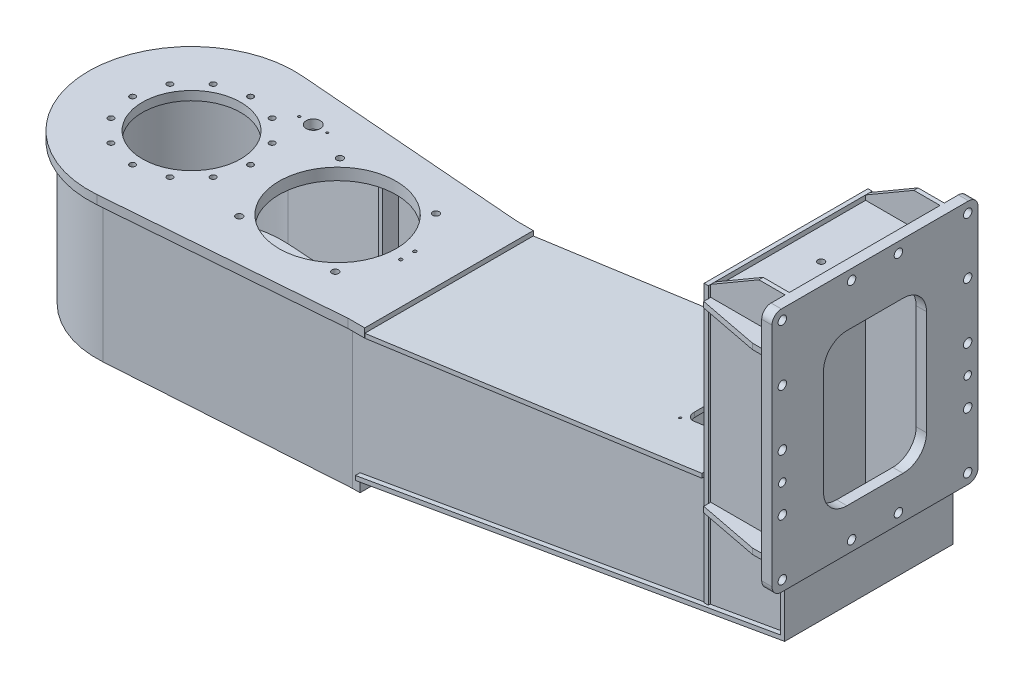
from build123d import *

# Parameters (mm, degrees)
SKETCH_1_R               = 203
SKETCH_1_R_2             = 194
EXTRUDE_1_DEPTH          = 301
CUT_EXTRUDE_1_DEPTH      = 416.955526469
CUT_EXTRUDE_1_DEPTH_BACK = 416.955526469
EXTRUDE_START            = 20
SKETCH_4_R               = 194
EXTRUDE_2_DEPTH          = 20
EXTRUDE_3_DEPTH          = 20
SKETCH_7_R               = 159
CUT_EXTRUDE_3_DEPTH      = 20
CUT_EXTRUDE_5_DEPTH      = 20
FILLET_1_R               = 25
EXTRUDE_4_DEPTH          = 301
SKETCH_11_R              = 220
EXTRUDE_5_DEPTH          = 19
EXTRUDE_6_DEPTH          = 19
SKETCH_13_W              = 300
SKETCH_13_H              = 270
EXTRUDE_7_DEPTH          = 6
EXTRUDE_8_DEPTH          = 12
CUT_EXTRUDE_7_DEPTH      = 12
EXTRUDE_9_DEPTH          = 9
EXTRUDE_10_DEPTH         = 9
EXTRUDE_11_DEPTH         = 180
EXTRUDE_11_DEPTH_BACK    = 180
EXTRUDE_12_DEPTH         = 180
EXTRUDE_12_DEPTH_BACK    = 180
EXTRUDE_13_DEPTH         = 161
EXTRUDE_13_DEPTH_BACK    = 161
CUT_EXTRUDE_8_DEPTH      = 9
SKETCH_31_W              = 350
SKETCH_31_H              = 591
EXTRUDE_14_DEPTH         = 9
EXTRUDE_16_DEPTH         = 9
EXTRUDE_17_DEPTH         = 9
EXTRUDE_18_DEPTH         = 12
EXTRUDE_19_DEPTH         = 12
SKETCH_43_W              = 159
SKETCH_43_H              = 322
EXTRUDE_20_DEPTH         = 12
EXTRUDE_21_DEPTH         = 22
CUT_EXTRUDE_10_DEPTH     = 22
EXTRUDE_22_DEPTH         = 301
SKETCH_50_R              = 105
CUT_EXTRUDE_12_DEPTH     = 19
SKETCH_52_R              = 6
CUT_EXTRUDE_14_DEPTH     = 19
SKETCH_54_R              = 15
CUT_EXTRUDE_16_DEPTH     = 19
SKETCH_56_R              = 2.5
CUT_EXTRUDE_18_DEPTH     = 19
SKETCH_59_R              = 125
CUT_EXTRUDE_20_DEPTH     = 25
SKETCH_61_R              = 7
CUT_EXTRUDE_22_DEPTH     = 25
SKETCH_63_R              = 3.4
CUT_EXTRUDE_24_DEPTH     = 25
CUT_EXTRUDE_25_DEPTH     = 9
SKETCH_65_R              = 2.5
CUT_EXTRUDE_26_DEPTH     = 9
SKETCH_67_R              = 65
CUT_EXTRUDE_28_DEPTH     = 9
SKETCH_69_R              = 2.5
CUT_EXTRUDE_30_DEPTH     = 9
SKETCH_71_R              = 7
CUT_EXTRUDE_32_DEPTH     = 12
SKETCH_73_R              = 9
CUT_EXTRUDE_34_DEPTH     = 22
SKETCH_75_R              = 8
CUT_EXTRUDE_36_DEPTH     = 22
EXTRUDE_23_DEPTH         = 9
EXTRUDE_24_DEPTH         = 9


with BuildPart() as part:
    # ｽｹｯﾁ1 → ﾎﾞｽ - 押し出し1 (new body)
    with BuildSketch(Plane(origin=(0, 0, 0), x_dir=(1, 0, 0), z_dir=(0, 1, 0))):
        with Locations(Location((0, 0, 0), (0, 0, 270))):
            Circle(SKETCH_1_R)
        with Locations(Location((0, 0, 0), (0, 0, 270))):
            Circle(SKETCH_1_R_2, mode=Mode.SUBTRACT)
    extrude(amount=-EXTRUDE_1_DEPTH)

    # ｽｹｯﾁ2 → ｶｯﾄ - 押し出し1 (cut, two sides: drawn at the far end of the back side and taken through both)
    with BuildSketch(Plane(origin=(0, 0, 0), x_dir=(1, 0, 0), z_dir=(0, 1, 0)).offset(-CUT_EXTRUDE_1_DEPTH_BACK)):
        Polygon((0, 0), (16.224897935, -249.47294981), (300, -249.47294981), (300, 249.47294981), (16.224897935, 249.47294981), align=None)
    extrude(amount=CUT_EXTRUDE_1_DEPTH + CUT_EXTRUDE_1_DEPTH_BACK, mode=Mode.SUBTRACT)

    # ｽｹｯﾁ4 → ﾎﾞｽ - 押し出し2 (add)
    with BuildSketch(Plane(origin=(0, -301, 0), x_dir=(1, 0, 0), z_dir=(0, 1, 0)).offset(EXTRUDE_START)):
        Circle(SKETCH_4_R)
    extrude(amount=-EXTRUDE_2_DEPTH)

    # ｽｹｯﾁ5 → ﾎﾞｽ - 押し出し3 (add)
    with BuildSketch(Plane(origin=(0, -301, 0), x_dir=(1, 0, 0), z_dir=(0, 1, 0))):
        Polygon((12.590520797, -193.591009053), (513.7, -161), (518, -161), (518, 161), (513.7, 161), (12.590520797, 193.591009053), align=None)
    extrude(amount=EXTRUDE_3_DEPTH)

    # ｽｹｯﾁ7 → ｶｯﾄ - 押し出し3 (cut)
    with BuildSketch(Plane(origin=(0, -301, 0), x_dir=(1, 0, 0), z_dir=(0, 1, 0))):
        with Locations(Location((0, 0, 0), (0, 0, 270))):
            Circle(SKETCH_7_R)
    extrude(amount=CUT_EXTRUDE_3_DEPTH, mode=Mode.SUBTRACT)

    # ｽｹｯﾁ9 → ｶｯﾄ - 押し出し5 (cut)
    with BuildSketch(Plane(origin=(0, -301, 0), x_dir=(1, 0, 0), z_dir=(0, 1, 0))):
        Polygon((10.319035087, -158.664796079), (468.0175, -128.897597336), (468.0175, 128.897597336), (10.319035087, 158.664796079), align=None)
    extrude(amount=CUT_EXTRUDE_5_DEPTH, mode=Mode.SUBTRACT)

    # ﾌｨﾚｯﾄ1
    fillet_1_edges = [part.edges().sort_by_distance(p)[0] for p in [
        (468.0175, -291, 128.897597336),
        (468.0175, -291, -128.897597336),
    ]]
    fillet(fillet_1_edges, radius=FILLET_1_R)

    # ｽｹｯﾁ10 → ﾎﾞｽ - 押し出し4 (add)
    with BuildSketch(Plane(origin=(0, 0, 0), x_dir=(1, 0, 0), z_dir=(0, 1, 0))):
        Polygon((12.590520797, 193.591009053), (513.7, 161), (530, 161), (530, 170), (514, 170), (13.174617123, 202.572035246), align=None)
        Polygon((12.590520797, -193.591009053), (513.7, -161), (530, -161), (530, -170), (514, -170), (13.174617123, -202.572035246), align=None)
    extrude(amount=-EXTRUDE_4_DEPTH)

    # ｽｹｯﾁ11 → ﾎﾞｽ - 押し出し5 (add)
    with BuildSketch(Plane(origin=(0, 0, 0), x_dir=(1, 0, 0), z_dir=(0, 1, 0))):
        with Locations(Location((0, 0, 0), (0, 0, 63.607016217))):
            Circle(SKETCH_11_R)
    extrude(amount=EXTRUDE_5_DEPTH)

    # ｽｹｯﾁ12 → ﾎﾞｽ - 押し出し6 (add)
    with BuildSketch(Plane(origin=(0, 0, 0), x_dir=(1, 0, 0), z_dir=(0, 1, 0))):
        Polygon((17.350560709, -219.314746524), (514.3, -180), (550, -180), (550, 180), (514.3, 180), (17.350560709, 219.314746524), align=None)
    extrude(amount=EXTRUDE_6_DEPTH)

    # ｽｹｯﾁ13 → ﾎﾞｽ - 押し出し7 (add)
    with BuildSketch(Plane(origin=(0, 0, 0), x_dir=(1, 0, 0), z_dir=(0, 1, 0))):
        with Locations((325, 0)):
            Rectangle(SKETCH_13_W, SKETCH_13_H)
    extrude(amount=-EXTRUDE_7_DEPTH)

    # ｽｹｯﾁ15 → ﾎﾞｽ - 押し出し8 (add)
    with BuildSketch(Plane(origin=(518, 0, 0), x_dir=(0, 0, -1), z_dir=(1, 0, 0))):
        Polygon((161, -301), (-161, -301), (-161, -7), (-151, 3), (151, 3), (161, -7), align=None)
    extrude(amount=EXTRUDE_8_DEPTH)

    # ｽｹｯﾁ17 → ｶｯﾄ - 押し出し7 (cut)
    with BuildSketch(Plane(origin=(518, 0, 0), x_dir=(0, 0, -1), z_dir=(1, 0, 0))):
        with BuildLine():
            Line((-111, -220), (-111, -97))
            ThreePointArc((-111, -97), (-102.213203436, -75.786796564), (-81, -67))
            Line((-81, -67), (81, -67))
            ThreePointArc((81, -67), (102.213203436, -75.786796564), (111, -97))
            Line((111, -97), (111, -220))
            ThreePointArc((111, -220), (102.213203436, -241.213203436), (81, -250))
            Line((81, -250), (-81, -250))
            ThreePointArc((-81, -250), (-102.213203436, -241.213203436), (-111, -220))
        make_face()
    extrude(amount=CUT_EXTRUDE_7_DEPTH, mode=Mode.SUBTRACT)

    # ｽｹｯﾁ20 → ﾎﾞｽ - 押し出し9 (add)
    with BuildSketch(Plane.XY.offset(161)):
        Polygon((530, -273.136944141), (1270, -143.555446343), (1270, 109.988063889), (530, 6.215108965), align=None)
    extrude(amount=EXTRUDE_9_DEPTH)

    # ｽｹｯﾁ21 → ﾎﾞｽ - 押し出し10 (add)
    with BuildSketch(Plane.XY.offset(-161)):
        Polygon((530, -273.136944141), (1270, -143.555446343), (1270, 109.988063889), (530, 6.215108965), align=None)
    extrude(amount=-EXTRUDE_10_DEPTH)

    # ｽｹｯﾁ22 → ﾎﾞｽ - 押し出し11 (add, two sides: drawn at the far end of the back side and taken through both)
    with BuildSketch(Plane.XY.offset(-EXTRUDE_11_DEPTH_BACK)):
        Polygon((551.2, 0.1), (1270, 100.9), (1270, 109.988063889), (549.950126354, 9.012789455), align=None)
    extrude(amount=EXTRUDE_11_DEPTH + EXTRUDE_11_DEPTH_BACK)

    # ｽｹｯﾁ23 → ﾎﾞｽ - 押し出し12 (add, two sides: drawn at the far end of the back side and taken through both)
    with BuildSketch(Plane.XY.offset(-EXTRUDE_12_DEPTH_BACK)):
        Polygon((530, -264), (1438, -105), (1438, -5), (1447, -5), (1447, -112.560952951), (530, -273.136944141), align=None)
    extrude(amount=EXTRUDE_12_DEPTH + EXTRUDE_12_DEPTH_BACK)

    # ｽｹｯﾁ24 → ﾎﾞｽ - 押し出し13 (add, two sides: drawn at the far end of the back side and taken through both)
    with BuildSketch(Plane.XY.offset(-EXTRUDE_13_DEPTH_BACK)):
        Polygon((909.050126354, 59.370719338), (917.962915808, 60.620592985), (954.346576527, -198.829559044), (945.476333395, -200.382828491), align=None)
    extrude(amount=EXTRUDE_13_DEPTH + EXTRUDE_13_DEPTH_BACK)

    # ｽｹｯﾁ29 → ｶｯﾄ - 押し出し8 (cut)
    with BuildSketch(Plane(origin=(908.595975782, 127.41579627, 0), x_dir=(0, 0, -1), z_dir=(0.9903099394368974, 0.1388748496038389, 0))):
        with BuildLine():
            Line((81, -270.017190662), (-81, -270.017190662))
            ThreePointArc((-81, -270.017190662), (-102.213203436, -261.230394097), (-111, -240.017190662))
            Line((-111, -240.017190662), (-111, -157.017190662))
            ThreePointArc((-111, -157.017190662), (-102.213203436, -135.803987226), (-81, -127.017190662))
            Line((-81, -127.017190662), (81, -127.017190662))
            ThreePointArc((81, -127.017190662), (102.213203436, -135.803987226), (111, -157.017190662))
            Line((111, -157.017190662), (111, -240.017190662))
            ThreePointArc((111, -240.017190662), (102.213203436, -261.230394097), (81, -270.017190662))
        make_face()
    extrude(amount=-CUT_EXTRUDE_8_DEPTH, mode=Mode.SUBTRACT)

    # ｽｹｯﾁ31 → ﾎﾞｽ - 押し出し14 (add)
    with BuildSketch(Plane(origin=(1270, 0, 0), x_dir=(0, 0, -1), z_dir=(1, 0, 0))):
        with Locations((0, 163.5)):
            Rectangle(SKETCH_31_W, SKETCH_31_H)
    extrude(amount=EXTRUDE_14_DEPTH)

    # ｽｹｯﾁ36 → ﾎﾞｽ - 押し出し16 (add)
    with BuildSketch(Plane.XY.offset(161)):
        Polygon((1279, -5), (1460, -5), (1460, 519), (1382, 519), (1279, 459), align=None)
    extrude(amount=EXTRUDE_16_DEPTH)

    # ｽｹｯﾁ37 → ﾎﾞｽ - 押し出し17 (add)
    with BuildSketch(Plane.XY.offset(-161)):
        Polygon((1279, -5), (1460, -5), (1460, 519), (1382, 519), (1279, 459), align=None)
    extrude(amount=-EXTRUDE_17_DEPTH)

    # ｽｹｯﾁ39 → ﾎﾞｽ - 押し出し18 (add)
    with BuildSketch(Plane(origin=(0, 44, 0), x_dir=(1, 0, 0), z_dir=(0, 1, 0))):
        Polygon((1279, 170), (1431, 170), (1438, 177), (1438, 203), (1431, 210), (1408, 210), (1279, 185), align=None)
        Polygon((1279, -170), (1431, -170), (1438, -177), (1438, -203), (1431, -210), (1408, -210), (1279, -185), align=None)
    extrude(amount=EXTRUDE_18_DEPTH)

    # ｽｹｯﾁ41 → ﾎﾞｽ - 押し出し19 (add)
    with BuildSketch(Plane(origin=(0, 423, 0), x_dir=(1, 0, 0), z_dir=(0, 1, 0))):
        Polygon((1279, 170), (1431, 170), (1438, 177), (1438, 203), (1431, 210), (1408, 210), (1279, 185), align=None)
        Polygon((1279, -170), (1431, -170), (1438, -177), (1438, -203), (1431, -210), (1408, -210), (1279, -185), align=None)
    extrude(amount=EXTRUDE_19_DEPTH)

    # ｽｹｯﾁ43 → ﾎﾞｽ - 押し出し20 (add)
    with BuildSketch(Plane(origin=(0, 437, 0), x_dir=(1, 0, 0), z_dir=(0, 1, 0))):
        with Locations((1358.5, 0)):
            Rectangle(SKETCH_43_W, SKETCH_43_H)
    extrude(amount=EXTRUDE_20_DEPTH)

    # ｽｹｯﾁ45 → ﾎﾞｽ - 押し出し21 (add)
    with BuildSketch(Plane(origin=(1438, 0, 0), x_dir=(0, 0, -1), z_dir=(1, 0, 0))):
        with BuildLine():
            Line((-220, 15), (-220, 499))
            ThreePointArc((-220, 499), (-214.142135624, 513.142135624), (-200, 519))
            Line((-200, 519), (200, 519))
            ThreePointArc((200, 519), (214.142135624, 513.142135624), (220, 499))
            Line((220, 499), (220, 15))
            ThreePointArc((220, 15), (214.142135624, 0.857864376), (200, -5))
            Line((200, -5), (-200, -5))
            ThreePointArc((-200, -5), (-214.142135624, 0.857864376), (-220, 15))
        make_face()
    extrude(amount=EXTRUDE_21_DEPTH)

    # ｽｹｯﾁ47 → ｶｯﾄ - 押し出し10 (cut)
    with BuildSketch(Plane(origin=(1438, 0, 0), x_dir=(0, 0, -1), z_dir=(1, 0, 0))):
        with BuildLine():
            Line((-110, 135), (-110, 359))
            ThreePointArc((-110, 359), (-95.355339059, 394.355339059), (-60, 409))
            Line((-60, 409), (60, 409))
            ThreePointArc((60, 409), (95.355339059, 394.355339059), (110, 359))
            Line((110, 359), (110, 135))
            ThreePointArc((110, 135), (95.355339059, 99.644660941), (60, 85))
            Line((60, 85), (-60, 85))
            ThreePointArc((-60, 85), (-95.355339059, 99.644660941), (-110, 135))
        make_face()
    extrude(amount=CUT_EXTRUDE_10_DEPTH, mode=Mode.SUBTRACT)

    # ｽｹｯﾁ48 → ﾎﾞｽ - 押し出し22 (add)
    with BuildSketch(Plane(origin=(0, 0, 0), x_dir=(1, 0, 0), z_dir=(0, 1, 0))):
        Polygon((253.6175, 145.9656), (262.6175, 145.3656), (264.7175, 177.193501799), (255.7175, 177.778832118), align=None)
        Polygon((253.6175, -145.9656), (262.6175, -145.3656), (264.7175, -177.193501799), (255.7175, -177.778832118), align=None)
    extrude(amount=-EXTRUDE_22_DEPTH)

    # ｽｹｯﾁ50 → ｶｯﾄ - 押し出し12 (cut)
    with BuildSketch(Plane(origin=(0, 0, 0), x_dir=(1, 0, 0), z_dir=(0, 1, 0))):
        with Locations(Location((0, 0, 0), (0, 0, 270))):
            Circle(SKETCH_50_R)
    extrude(amount=CUT_EXTRUDE_12_DEPTH, mode=Mode.SUBTRACT)

    # ｽｹｯﾁ52 → ｶｯﾄ - 押し出し14 (cut)
    with BuildSketch(Plane(origin=(0, 0, 0), x_dir=(1, 0, 0), z_dir=(0, 1, 0))):
        with Locations(Location((126, 0, 0), (0, 0, 270))):
            Circle(SKETCH_52_R)
        with Locations(Location((109.119200877, -63, 0), (0, 0, 270))):
            Circle(SKETCH_52_R)
        with Locations(Location((63, -109.119200877, 0), (0, 0, 270))):
            Circle(SKETCH_52_R)
        with Locations(Location((0, -126, 0), (0, 0, 270))):
            Circle(SKETCH_52_R)
        with Locations(Location((-63, -109.119200877, 0), (0, 0, 270))):
            Circle(SKETCH_52_R)
        with Locations(Location((-109.119200877, -63, 0), (0, 0, 270))):
            Circle(SKETCH_52_R)
        with Locations(Location((-126, 0, 0), (0, 0, 270))):
            Circle(SKETCH_52_R)
        with Locations(Location((-109.119200877, 63, 0), (0, 0, 270))):
            Circle(SKETCH_52_R)
        with Locations(Location((-63, 109.119200877, 0), (0, 0, 270))):
            Circle(SKETCH_52_R)
        with Locations(Location((0, 126, 0), (0, 0, 270))):
            Circle(SKETCH_52_R)
        with Locations(Location((63, 109.119200877, 0), (0, 0, 270))):
            Circle(SKETCH_52_R)
        with Locations(Location((109.119200877, 63, 0), (0, 0, 270))):
            Circle(SKETCH_52_R)
    extrude(amount=CUT_EXTRUDE_14_DEPTH, mode=Mode.SUBTRACT)

    # ｽｹｯﾁ54 → ｶｯﾄ - 押し出し16 (cut)
    with BuildSketch(Plane(origin=(0, 0, 0), x_dir=(1, 0, 0), z_dir=(0, 1, 0))):
        with Locations(Location((119, 141, 0), (0, 0, 270))):
            Circle(SKETCH_54_R)
    extrude(amount=CUT_EXTRUDE_16_DEPTH, mode=Mode.SUBTRACT)

    # ｽｹｯﾁ56 → ｶｯﾄ - 押し出し18 (cut)
    with BuildSketch(Plane(origin=(0, 0, 0), x_dir=(1, 0, 0), z_dir=(0, 1, 0))):
        with Locations(Location((89, 141, 0), (0, 0, 270))):
            Circle(SKETCH_56_R)
        with Locations(Location((149, 141, 0), (0, 0, 270))):
            Circle(SKETCH_56_R)
    extrude(amount=CUT_EXTRUDE_18_DEPTH, mode=Mode.SUBTRACT)

    # ｽｹｯﾁ59 → ｶｯﾄ - 押し出し20 (cut)
    with BuildSketch(Plane(origin=(0, -6, 0), x_dir=(1, 0, 0), z_dir=(0, 1, 0))):
        with Locations(Location((312, 0, 0), (0, 0, 270))):
            Circle(SKETCH_59_R)
    extrude(amount=CUT_EXTRUDE_20_DEPTH, mode=Mode.SUBTRACT)

    # ｽｹｯﾁ61 → ｶｯﾄ - 押し出し22 (cut)
    with BuildSketch(Plane(origin=(0, -6, 0), x_dir=(1, 0, 0), z_dir=(0, 1, 0))):
        with Locations(Location((209.5, 107.5, 0), (0, 0, 270))):
            Circle(SKETCH_61_R)
        with Locations(Location((209.5, -107.5, 0), (0, 0, 270))):
            Circle(SKETCH_61_R)
        with Locations(Location((414.5, 107.5, 0), (0, 0, 270))):
            Circle(SKETCH_61_R)
        with Locations(Location((414.5, -107.5, 0), (0, 0, 270))):
            Circle(SKETCH_61_R)
    extrude(amount=CUT_EXTRUDE_22_DEPTH, mode=Mode.SUBTRACT)

    # ｽｹｯﾁ63 → ｶｯﾄ - 押し出し24 (cut)
    with BuildSketch(Plane(origin=(0, -6, 0), x_dir=(1, 0, 0), z_dir=(0, 1, 0))):
        with Locations(Location((462, 15, 0), (0, 0, 270))):
            Circle(SKETCH_63_R)
        with Locations(Location((462, -15, 0), (0, 0, 270))):
            Circle(SKETCH_63_R)
    extrude(amount=CUT_EXTRUDE_24_DEPTH, mode=Mode.SUBTRACT)

    # ｽｹｯﾁ64 → ｶｯﾄ - 押し出し25 (cut)
    with BuildSketch(Plane(origin=(9.366940027, -66.795203285, 0), x_dir=(0.9903099394368974, 0.13887484960383872, 0), z_dir=(-0.1388748496038387, 0.9903099394368973, 0))):
        with BuildLine():
            Line((1205.576858653, 55), (1205.576858653, -55))
            ThreePointArc((1205.576858653, -55), (1199.718994277, -69.142135624), (1185.576858653, -75))
            Line((1185.576858653, -75), (1150.576858653, -75))
            ThreePointArc((1150.576858653, -75), (1136.434723029, -69.142135624), (1130.576858653, -55))
            Line((1130.576858653, -55), (1130.576858653, 55))
            ThreePointArc((1130.576858653, 55), (1136.434723029, 69.142135624), (1150.576858653, 75))
            Line((1150.576858653, 75), (1185.576858653, 75))
            ThreePointArc((1185.576858653, 75), (1199.718994277, 69.142135624), (1205.576858653, 55))
        make_face()
    extrude(amount=-CUT_EXTRUDE_25_DEPTH, mode=Mode.SUBTRACT)

    # ｽｹｯﾁ65 → ｶｯﾄ - 押し出し26 (cut)
    with BuildSketch(Plane(origin=(9.366940027, -66.795203285, 0), x_dir=(0.9903099394368974, 0.13887484960383872, 0), z_dir=(-0.1388748496038387, 0.9903099394368973, 0))):
        with Locations(Location((1125.576858653, 80, 0), (0, 0, 180))):
            Circle(SKETCH_65_R)
        with Locations(Location((1125.576858653, -80, 0), (0, 0, 180))):
            Circle(SKETCH_65_R)
        with Locations(Location((1210.576858653, 80, 0), (0, 0, 180))):
            Circle(SKETCH_65_R)
        with Locations(Location((1210.576858653, -80, 0), (0, 0, 180))):
            Circle(SKETCH_65_R)
    extrude(amount=-CUT_EXTRUDE_26_DEPTH, mode=Mode.SUBTRACT)

    # ｽｹｯﾁ67 → ｶｯﾄ - 押し出し28 (cut)
    with BuildSketch(Plane(origin=(1270, 0, 0), x_dir=(0, 0, -1), z_dir=(1, 0, 0))):
        with Locations((0, 319)):
            Circle(SKETCH_67_R)
    extrude(amount=CUT_EXTRUDE_28_DEPTH, mode=Mode.SUBTRACT)

    # ｽｹｯﾁ69 → ｶｯﾄ - 押し出し30 (cut)
    with BuildSketch(Plane(origin=(1270, 0, 0), x_dir=(0, 0, -1), z_dir=(1, 0, 0))):
        with Locations((-53.033008589, 372.033008589)):
            Circle(SKETCH_69_R)
        with Locations((53.033008589, 372.033008589)):
            Circle(SKETCH_69_R)
        with Locations((53.033008589, 265.966991411)):
            Circle(SKETCH_69_R)
        with Locations((-53.033008589, 265.966991411)):
            Circle(SKETCH_69_R)
    extrude(amount=CUT_EXTRUDE_30_DEPTH, mode=Mode.SUBTRACT)

    # ｽｹｯﾁ71 → ｶｯﾄ - 押し出し32 (cut)
    with BuildSketch(Plane(origin=(0, 437, 0), x_dir=(1, 0, 0), z_dir=(0, 1, 0))):
        with Locations(Location((1345, 0, 0), (0, 0, 270))):
            Circle(SKETCH_71_R)
    extrude(amount=CUT_EXTRUDE_32_DEPTH, mode=Mode.SUBTRACT)

    # ｽｹｯﾁ73 → ｶｯﾄ - 押し出し34 (cut)
    with BuildSketch(Plane(origin=(1438, 0, 0), x_dir=(0, 0, -1), z_dir=(1, 0, 0))):
        with Locations((198, 17)):
            Circle(SKETCH_73_R)
        with Locations((198, 137)):
            Circle(SKETCH_73_R)
        with Locations((198, 257)):
            Circle(SKETCH_73_R)
        with Locations((198, 377)):
            Circle(SKETCH_73_R)
        with Locations((198, 497)):
            Circle(SKETCH_73_R)
        with Locations((-198, 17)):
            Circle(SKETCH_73_R)
        with Locations((-198, 137)):
            Circle(SKETCH_73_R)
        with Locations((-198, 257)):
            Circle(SKETCH_73_R)
        with Locations((-198, 377)):
            Circle(SKETCH_73_R)
        with Locations((-198, 497)):
            Circle(SKETCH_73_R)
        with Locations((50, 17)):
            Circle(SKETCH_73_R)
        with Locations((50, 497)):
            Circle(SKETCH_73_R)
        with Locations((-50, 17)):
            Circle(SKETCH_73_R)
        with Locations((-50, 497)):
            Circle(SKETCH_73_R)
    extrude(amount=CUT_EXTRUDE_34_DEPTH, mode=Mode.SUBTRACT)

    # ｽｹｯﾁ75 → ｶｯﾄ - 押し出し36 (cut)
    with BuildSketch(Plane(origin=(1438, 0, 0), x_dir=(0, 0, -1), z_dir=(1, 0, 0))):
        with Locations((198, 197)):
            Circle(SKETCH_75_R)
        with Locations((-198, 197)):
            Circle(SKETCH_75_R)
    extrude(amount=CUT_EXTRUDE_36_DEPTH, mode=Mode.SUBTRACT)

    # ｽｹｯﾁ78 → ﾎﾞｽ - 押し出し23 (add)
    with BuildSketch(Plane.XY.offset(161)):
        Polygon((1279, -136.842511013), (1444, -107.949339207), (1444, 300), (1279, 300), align=None)
    extrude(amount=EXTRUDE_23_DEPTH)

    # ｽｹｯﾁ79 → ﾎﾞｽ - 押し出し24 (add)
    with BuildSketch(Plane.XY.offset(-161)):
        Polygon((1279, -136.842511013), (1444, -107.949339207), (1444, 300), (1279, 300), align=None)
    extrude(amount=-EXTRUDE_24_DEPTH)


solid = part.part
